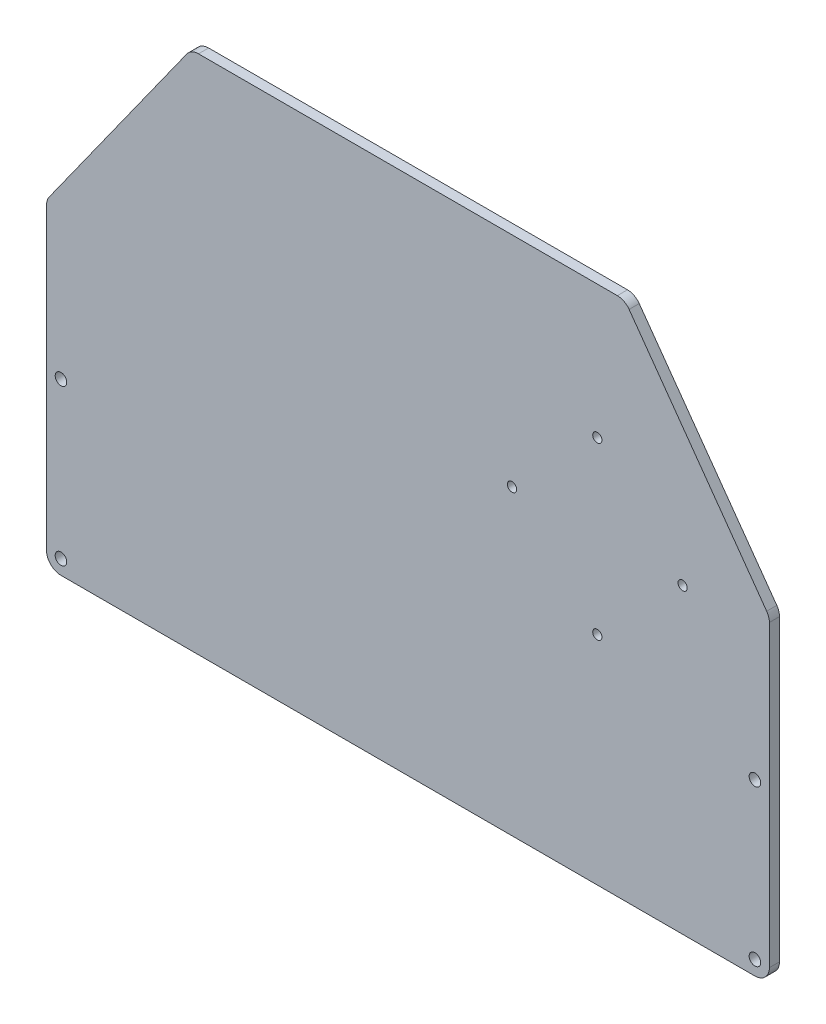
from build123d import *

# Parameters (mm, degrees)
BOSS_EXTRU_1_DEPTH           = 3.5
ESQUISSE2_R                  = 2
ENL_V_MAT_EXTRU_1_DEPTH      = 395.382111663
ENL_V_MAT_EXTRU_2_DEPTH      = 395.382111663
ENL_V_MAT_EXTRU_2_DEPTH_BACK = 395.382111663
CONG_1_R                     = 5
ESQUISSE4_R                  = 1.6
ENL_V_MAT_EXTRU_4_DEPTH      = 309.078317965


with BuildPart() as part:
    # Esquisse1 → Boss.-Extru.1 (new body)
    with BuildSketch(Plane.XY):
        with BuildLine():
            Line((5, 0), (245, 0))
            ThreePointArc((245, 0), (248.535533906, 1.464466094), (250, 5))
            Line((250, 5), (250, 305))
            Line((250, 305), (0, 305))
            Line((0, 305), (0, 5))
            ThreePointArc((0, 5), (1.464466094, 1.464466094), (5, 0))
        make_face()
    extrude(amount=BOSS_EXTRU_1_DEPTH)

    # Esquisse2 → Enlèv. mat.-Extru.1 (cut, through all)
    with BuildSketch(Plane.XY.offset(3.5)):
        with Locations((5, 5)):
            Circle(ESQUISSE2_R)
        with Locations((245, 5)):
            Circle(ESQUISSE2_R)
        with Locations((5, 58.8)):
            Circle(ESQUISSE2_R)
        with Locations((245, 58.8)):
            Circle(ESQUISSE2_R)
    extrude(amount=-ENL_V_MAT_EXTRU_1_DEPTH, mode=Mode.SUBTRACT)

    # Esquisse3 → Enlèv. mat.-Extru.2 (cut, two sides: drawn at the far end of the back side and taken through both)
    with BuildSketch(Plane.XY.offset(3.5).offset(-ENL_V_MAT_EXTRU_2_DEPTH_BACK)):
        Polygon((-374.383398967, -414.136758554), (0, 110), (50, 180), (200, 180), (250, 110), (624.383398967, -414.136758554), (624.383398967, 874.090350445), (-374.383398967, 874.090350445), align=None)
    extrude(amount=ENL_V_MAT_EXTRU_2_DEPTH + ENL_V_MAT_EXTRU_2_DEPTH_BACK, mode=Mode.SUBTRACT)

    # Congé1
    cong_1_edges = [part.edges().sort_by_distance(p)[0] for p in [
        (50, 180, 1.75),
        (200, 180, 1.75),
        (250, 110, 1.75),
        (0, 110, 1.75),
    ]]
    fillet(cong_1_edges, radius=CONG_1_R)

    # Esquisse4 → Enlèv. mat.-Extru.4 (cut, through all)
    with BuildSketch(Plane.XY.offset(3.5)):
        with Locations((220, 104.5)):
            Circle(ESQUISSE4_R)
        with Locations((190.499010186, 134)):
            Circle(ESQUISSE4_R)
        with Locations((160.998020372, 104.5)):
            Circle(ESQUISSE4_R)
        with Locations((190.499010186, 75)):
            Circle(ESQUISSE4_R)
    extrude(amount=-ENL_V_MAT_EXTRU_4_DEPTH, mode=Mode.SUBTRACT)


solid = part.part
